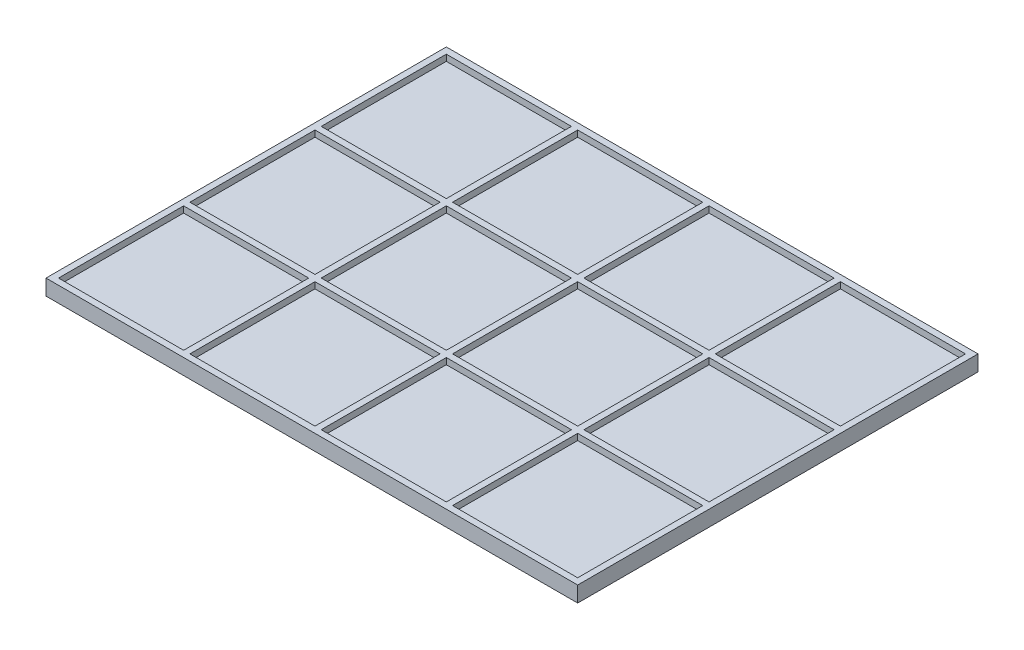
from build123d import *

# Parameters (mm, degrees)
EXTRUDE_1_DEPTH     = 5
SKETCH_5_W          = 40
SKETCH_5_H          = 40
CUT_EXTRUDE_1_DEPTH = 2
SKETCH_7_R          = 2.5
CUT_EXTRUDE_2_DEPTH = 1.6
SKETCH_8_R          = 2.6
CUT_EXTRUDE_3_DEPTH = 1.6
SKETCH_9_R          = 5.1
CUT_EXTRUDE_4_DEPTH = 1.6


with BuildPart() as part:
    # 草图4 → 凸台-拉伸1 (new body)
    with BuildSketch(Plane(origin=(0, 0, 0), x_dir=(1, 0, 0), z_dir=(0, 1, 0))):
        Polygon((-85, 0), (0, 0), (85, 0), (85, 64), (-85, 64), align=None)
        Polygon((85, 0), (0, 0), (-85, 0), (-85, -64), (85, -64), align=None)
    extrude(amount=EXTRUDE_1_DEPTH)

    # 草图5 → 切除-拉伸1 (cut)
    with BuildSketch(Plane(origin=(0, 5, 0), x_dir=(1, 0, 0), z_dir=(0, 1, 0))):
        with Locations((-21, 42)):
            Rectangle(SKETCH_5_W, SKETCH_5_H)
        with Locations((-63, 42)):
            Rectangle(SKETCH_5_W, SKETCH_5_H)
        with Locations((21, 42)):
            Rectangle(SKETCH_5_W, SKETCH_5_H)
        with Locations((63, 42)):
            Rectangle(SKETCH_5_W, SKETCH_5_H)
        with Locations((-21, 0)):
            Rectangle(SKETCH_5_W, SKETCH_5_H)
        with Locations((21, 0)):
            Rectangle(SKETCH_5_W, SKETCH_5_H)
        with Locations((63, 0)):
            Rectangle(SKETCH_5_W, SKETCH_5_H)
        with Locations((-21, -42)):
            Rectangle(SKETCH_5_W, SKETCH_5_H)
        with Locations((21, -42)):
            Rectangle(SKETCH_5_W, SKETCH_5_H)
        with Locations((63, -42)):
            Rectangle(SKETCH_5_W, SKETCH_5_H)
        with Locations((-63, 0)):
            Rectangle(SKETCH_5_W, SKETCH_5_H)
        with Locations((-63, -42)):
            Rectangle(SKETCH_5_W, SKETCH_5_H)
    extrude(amount=-CUT_EXTRUDE_1_DEPTH, mode=Mode.SUBTRACT)

    # 草图7 → 切除-拉伸2 (cut)
    with BuildSketch(Plane.XZ):
        with Locations(Location((-50, 40, 0), (0, 0, 270))):
            Circle(SKETCH_7_R)
        with Locations(Location((50, 40, 0), (0, 0, 270))):
            Circle(SKETCH_7_R)
        with Locations(Location((50, -40, 0), (0, 0, 270))):
            Circle(SKETCH_7_R)
        with Locations(Location((-50, -40, 0), (0, 0, 270))):
            Circle(SKETCH_7_R)
    extrude(amount=-CUT_EXTRUDE_2_DEPTH, mode=Mode.SUBTRACT)

    # 草图8 → 切除-拉伸3 (cut)
    with BuildSketch(Plane.XZ):
        with Locations(Location((-50, 40, 0), (0, 0, 270))):
            Circle(SKETCH_8_R)
        with Locations(Location((50, 40, 0), (0, 0, 270))):
            Circle(SKETCH_8_R)
        with Locations(Location((50, -40, 0), (0, 0, 270))):
            Circle(SKETCH_8_R)
        with Locations(Location((-50, -40, 0), (0, 0, 270))):
            Circle(SKETCH_8_R)
    extrude(amount=-CUT_EXTRUDE_3_DEPTH, mode=Mode.SUBTRACT)

    # 草图9 → 切除-拉伸4 (cut)
    with BuildSketch(Plane.XZ):
        with Locations(Location((-50, 40, 0), (0, 0, 270))):
            Circle(SKETCH_9_R)
        with Locations(Location((50, 40, 0), (0, 0, 270))):
            Circle(SKETCH_9_R)
        with Locations(Location((50, -40, 0), (0, 0, 270))):
            Circle(SKETCH_9_R)
        with Locations(Location((-50, -40, 0), (0, 0, 270))):
            Circle(SKETCH_9_R)
    extrude(amount=-CUT_EXTRUDE_4_DEPTH, mode=Mode.SUBTRACT)


solid = part.part
